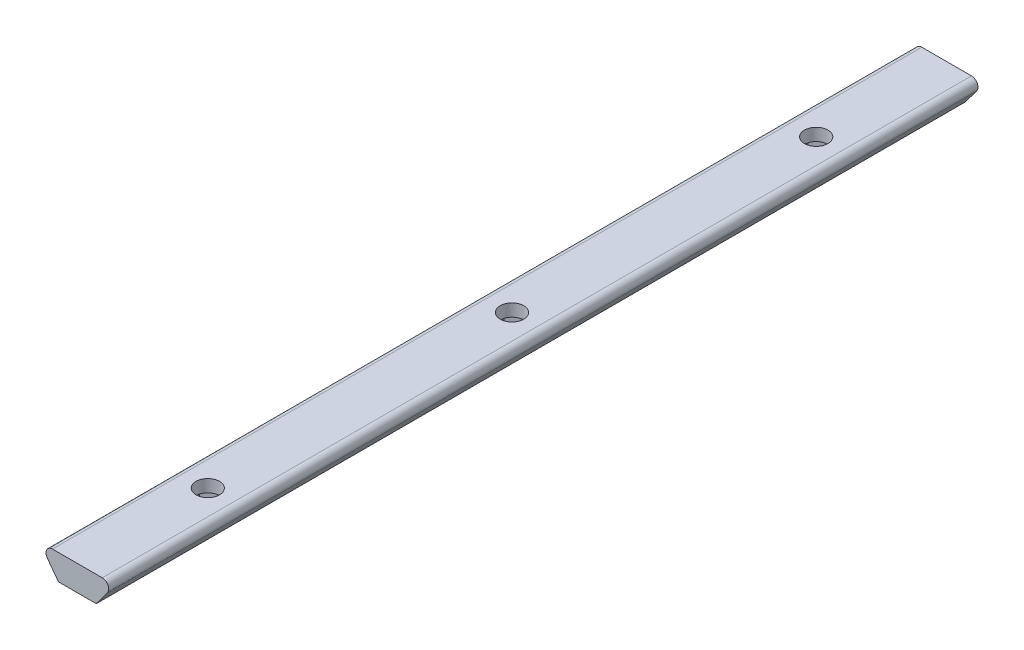
from build123d import *

# Parameters (mm, degrees)
BOSS_EXTRUDE1_DEPTH = 133.3
FILLET1_R           = 1
SKETCH2_R           = 1.8
CUT_EXTRUDE1_DEPTH  = 200
CUT_EXTRUDE2_DEPTH  = 2
LPATTERN1_COUNT     = 3
LPATTERN1_PITCH     = 46.65


with BuildPart() as part:
    # Sketch1 → Boss-Extrude1 (new body)
    with BuildSketch(Plane.XY):
        Polygon((0, 0), (5.8, 0), (8.7, 3.9), (-2.9, 3.9), align=None)
    extrude(amount=BOSS_EXTRUDE1_DEPTH)

    # Fillet1
    fillet1_edges = [part.edges().sort_by_distance(p)[0] for p in [
        (-2.9, 3.9, 66.65),
        (8.7, 3.9, 66.65),
    ]]
    fillet(fillet1_edges, radius=FILLET1_R)

    # Sketch2 → Cut-Extrude1 (cut)
    with BuildSketch(Plane.XZ):
        with Locations(Location((2.9, 113.3, 0), (0, 0, 270))):
            Circle(SKETCH2_R)
    cut_extrude1 = extrude(amount=-CUT_EXTRUDE1_DEPTH, mode=Mode.SUBTRACT)

    # Sketch3 → Cut-Extrude2 (cut)
    with BuildSketch(Plane.XZ):
        Polygon((5.787553908, 111.604309651), (5.812287873, 114.952849865), (2.924733965, 116.648540214), (0.012446092, 114.995690349), (-0.012287873, 111.647150135), (2.875266035, 109.951459786), align=None)
    cut_extrude2 = extrude(amount=-CUT_EXTRUDE2_DEPTH, mode=Mode.SUBTRACT)

    # LPattern1: Cut-Extrude1, Cut-Extrude2 ×3
    with Locations(*[(0, 0, -i * LPATTERN1_PITCH) for i in range(1, LPATTERN1_COUNT)]):
        add(cut_extrude1, mode=Mode.SUBTRACT)
        add(cut_extrude2, mode=Mode.SUBTRACT)


solid = part.part
